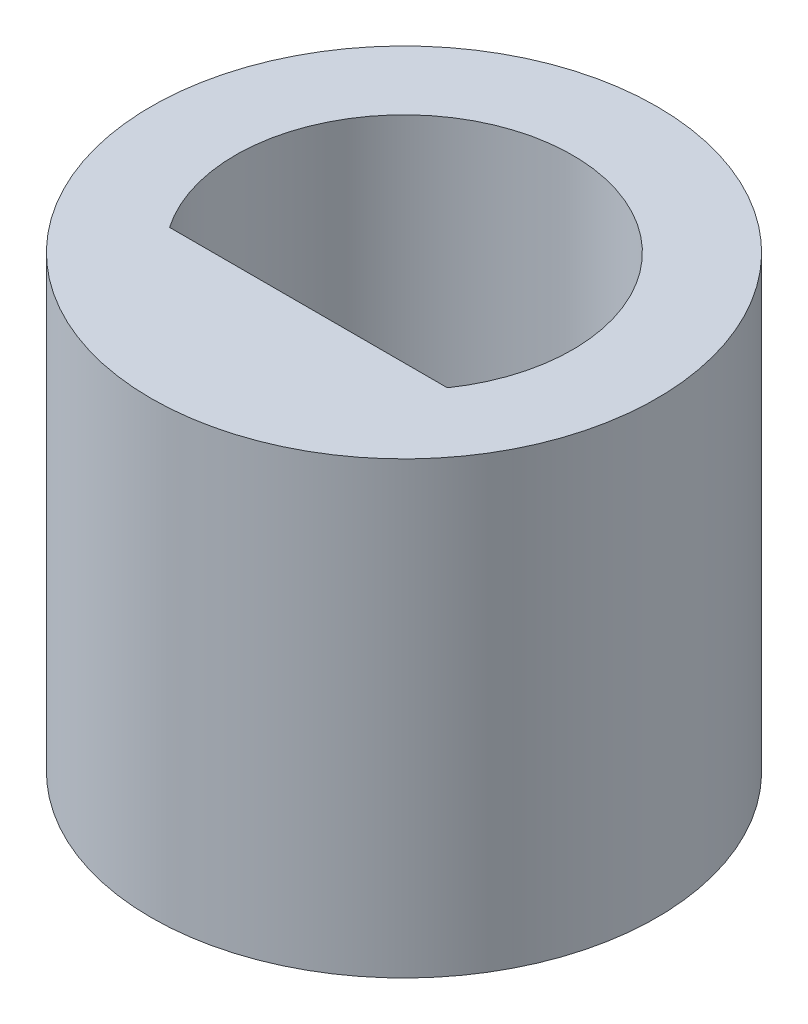
from build123d import *

# Parameters (mm, degrees)
SKETCH1_R           = 2.25
BOSS_EXTRUDE1_DEPTH = 4
SKETCH1_4_R         = 1.5
BOSS_EXTRUDE2_DEPTH = 0.5


with BuildPart() as part:
    # Sketch1 → Boss-Extrude1 (new body)
    with BuildSketch(Plane(origin=(0, 0, 0), x_dir=(1, 0, 0), z_dir=(0, 1, 0))):
        Circle(SKETCH1_R)
        with BuildLine():
            Line((1.235920709, -0.85), (-1.235920709, -0.85))
            ThreePointArc((-1.235920709, -0.85), (0, 1.5), (1.235920709, -0.85))
        make_face(mode=Mode.SUBTRACT)
    extrude(amount=BOSS_EXTRUDE1_DEPTH)

    # Sketch1<4> → Boss-Extrude2 (add)
    with BuildSketch(Plane(origin=(0, 0, 0), x_dir=(1, 0, 0), z_dir=(0, 1, 0))):
        Circle(SKETCH1_4_R)
    extrude(amount=BOSS_EXTRUDE2_DEPTH)


solid = part.part
